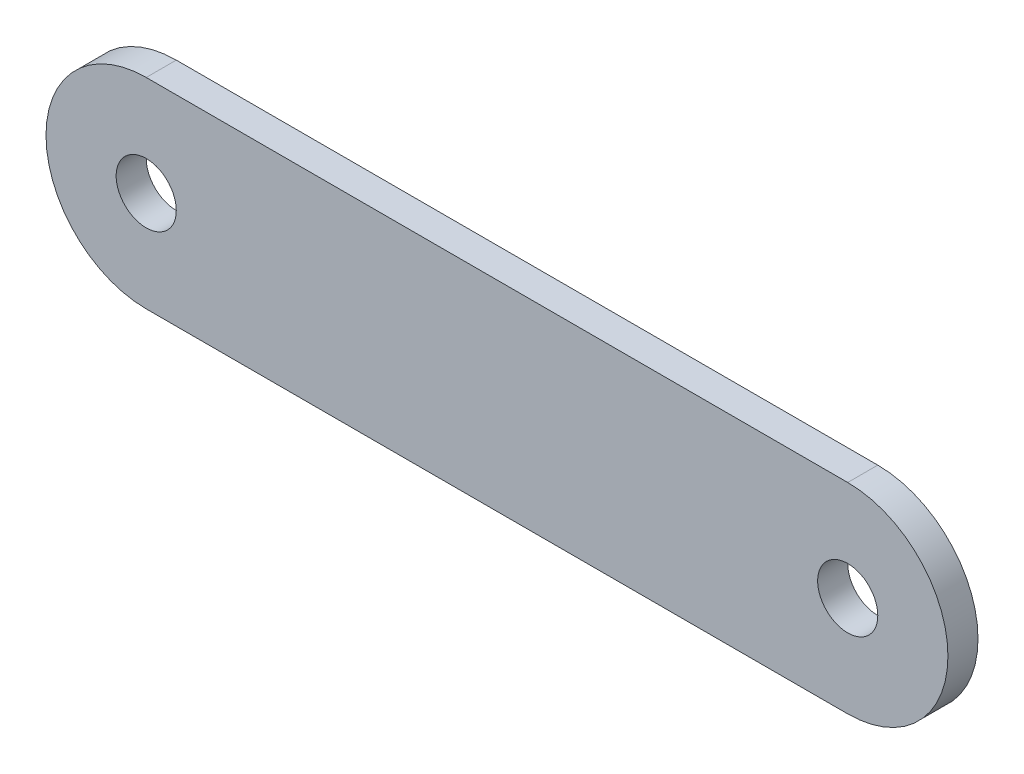
from build123d import *

# Parameters (mm, degrees)
SKETCH_1_R      = 3
EXTRUDE_1_DEPTH = 3


with BuildPart() as part:
    # 草图1 → 凸台-拉伸1 (new body)
    with BuildSketch(Plane.XY):
        with BuildLine():
            Line((0, 10), (70, 10))
            ThreePointArc((70, 10), (80, 0), (70, -10))
            Line((70, -10), (0, -10))
            ThreePointArc((0, -10), (-10, 0), (0, 10))
        make_face()
        Circle(SKETCH_1_R, mode=Mode.SUBTRACT)
        with Locations((70, 0)):
            Circle(SKETCH_1_R, mode=Mode.SUBTRACT)
    extrude(amount=EXTRUDE_1_DEPTH)


solid = part.part
